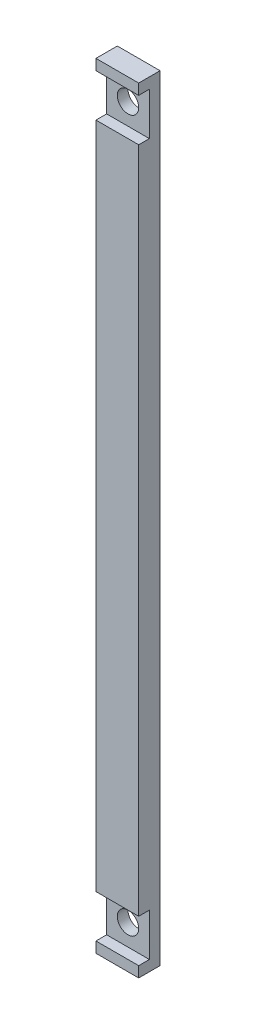
from build123d import *

# Parameters (mm, degrees)
SKETCH1_W           = 25.4
SKETCH1_H           = 12.7
BOSS_EXTRUDE1_DEPTH = 460.375
SKETCH2_W           = 6.35
SKETCH2_H           = 25.4
CUT_EXTRUDE1_DEPTH  = 462.250030488
SKETCH3_R           = 6.35
CUT_EXTRUDE2_DEPTH  = 462.11888177


with BuildPart() as part:
    # Sketch1 → Boss-Extrude1 (new body)
    with BuildSketch(Plane(origin=(0, 0, 0), x_dir=(1, 0, 0), z_dir=(0, 1, 0))):
        with Locations((12.7, 6.35)):
            Rectangle(SKETCH1_W, SKETCH1_H)
    extrude(amount=BOSS_EXTRUDE1_DEPTH)

    # Sketch2 → Cut-Extrude1 (cut, through all)
    with BuildSketch(Plane(origin=(25.4, 0, 0), x_dir=(0, 0, -1), z_dir=(1, 0, 0))):
        with Locations((3.175, 441.325)):
            Rectangle(SKETCH2_W, SKETCH2_H)
        with Locations((3.175, 19.05)):
            Rectangle(SKETCH2_W, SKETCH2_H)
    extrude(amount=-CUT_EXTRUDE1_DEPTH, mode=Mode.SUBTRACT)

    # Sketch3 → Cut-Extrude2 (cut, through all)
    with BuildSketch(Plane.XY.offset(-6.35)):
        with Locations((12.7, 441.325)):
            Circle(SKETCH3_R)
        with Locations((12.7, 19.05)):
            Circle(SKETCH3_R)
    extrude(amount=-CUT_EXTRUDE2_DEPTH, mode=Mode.SUBTRACT)


solid = part.part
